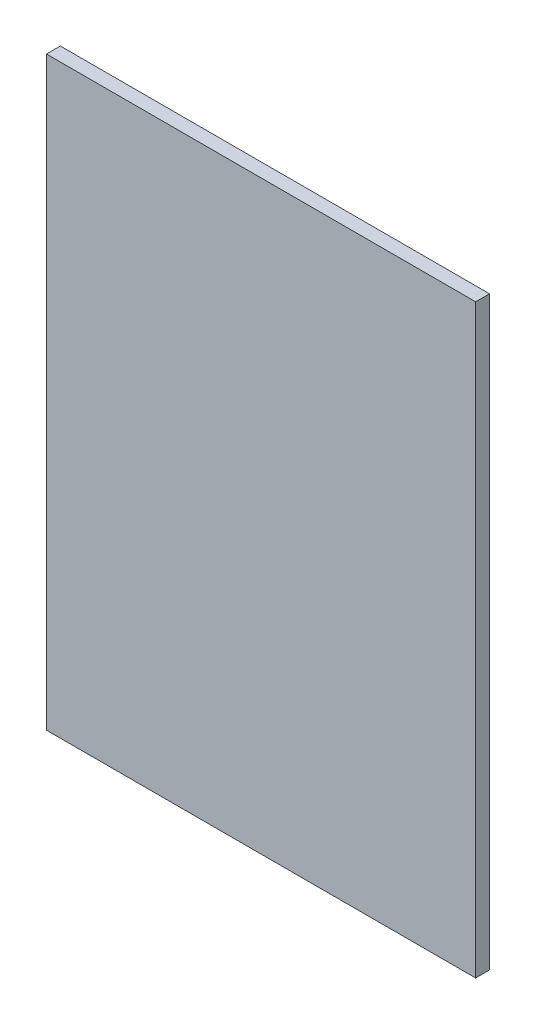
from build123d import *

# Parameters (mm, degrees)
SZKIC1_W                    = 557
SZKIC1_H                    = 760
DODANIE_WYCI_GNI_CIE1_DEPTH = 18


with BuildPart() as part:
    # Szkic1 → Dodanie-wyciągnięcie1 (new body)
    with BuildSketch(Plane.XY):
        with Locations((278.5, 380)):
            Rectangle(SZKIC1_W, SZKIC1_H)
    extrude(amount=DODANIE_WYCI_GNI_CIE1_DEPTH)


solid = part.part
